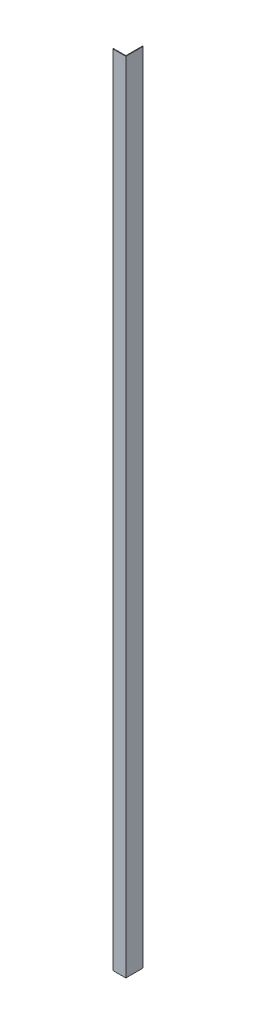
from build123d import *

# Parameters (mm, degrees)
OVEN_SOVE_SOL_1_START = 120
OVEN_SOVE_SOL_1_DEPTH = 1850


with BuildPart() as part:
    # Sketch1 → OVEN_sove_sol_1 (new body)
    with BuildSketch(Plane(origin=(0, 0, 0), x_dir=(1, 0, 0), z_dir=(0, 1, 0)).offset(OVEN_SOVE_SOL_1_START)):
        Polygon((0, -40), (0, -38.5), (28.5, -38.5), (28.5, 0), (30, 0), (30, -40), align=None)
    extrude(amount=OVEN_SOVE_SOL_1_DEPTH)


solid = part.part
